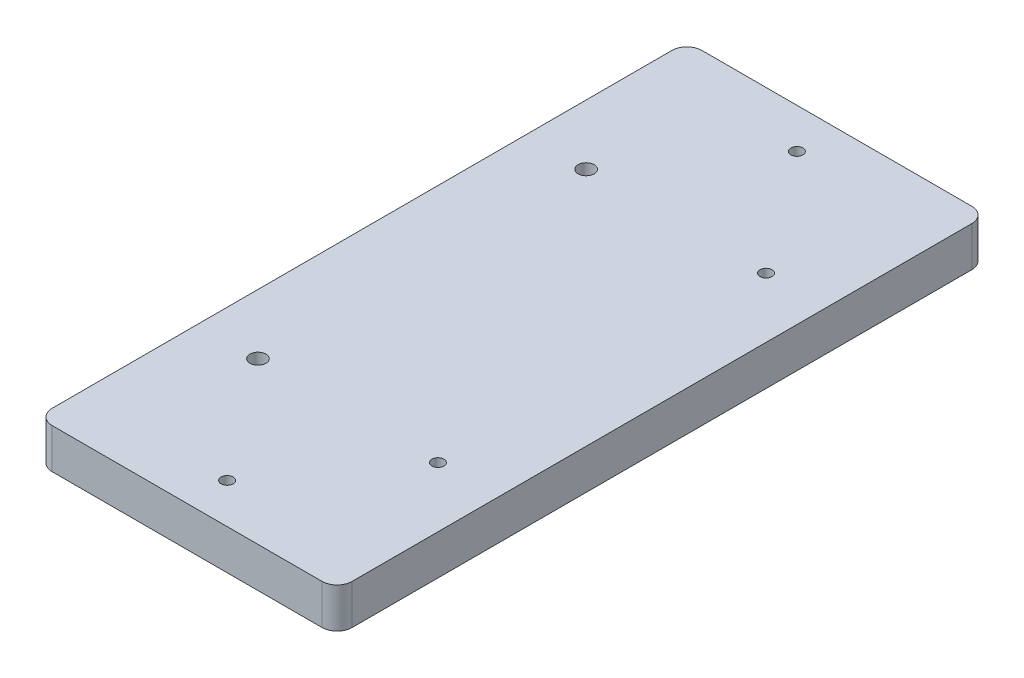
from build123d import *

# Parameters (mm, degrees)
SKETCH1_W           = 60
SKETCH1_H           = 130
SKETCH1_R           = 1.6
SKETCH1_R_2         = 1.2
BOSS_EXTRUDE1_DEPTH = 8
FILLET1_R           = 3


with BuildPart() as part:
    # Sketch1 → Boss-Extrude1 (new body)
    with BuildSketch(Plane(origin=(0, 0, 0), x_dir=(1, 0, 0), z_dir=(0, 1, 0))):
        with Locations((30, 65)):
            Rectangle(SKETCH1_W, SKETCH1_H)
        with Locations(Location((12, 97.825, 0), (0, 0, 270))):
            Circle(SKETCH1_R, mode=Mode.SUBTRACT)
        with Locations(Location((12, 32.175, 0), (0, 0, 270))):
            Circle(SKETCH1_R, mode=Mode.SUBTRACT)
        with Locations(Location((48, 97.825, 0), (0, 0, 270))):
            Circle(SKETCH1_R_2, mode=Mode.SUBTRACT)
        with Locations(Location((48, 32.175, 0), (0, 0, 270))):
            Circle(SKETCH1_R_2, mode=Mode.SUBTRACT)
        with Locations(Location((30, 8, 0), (0, 0, 270))):
            Circle(SKETCH1_R_2, mode=Mode.SUBTRACT)
        with Locations(Location((30, 122, 0), (0, 0, 270))):
            Circle(SKETCH1_R_2, mode=Mode.SUBTRACT)
    extrude(amount=BOSS_EXTRUDE1_DEPTH)

    # Fillet1
    fillet1_edges = [part.edges().sort_by_distance(p)[0] for p in [
        (0, 4, 0),
        (0, 4, -130),
        (60, 4, -130),
        (60, 4, 0),
    ]]
    fillet(fillet1_edges, radius=FILLET1_R)


solid = part.part
